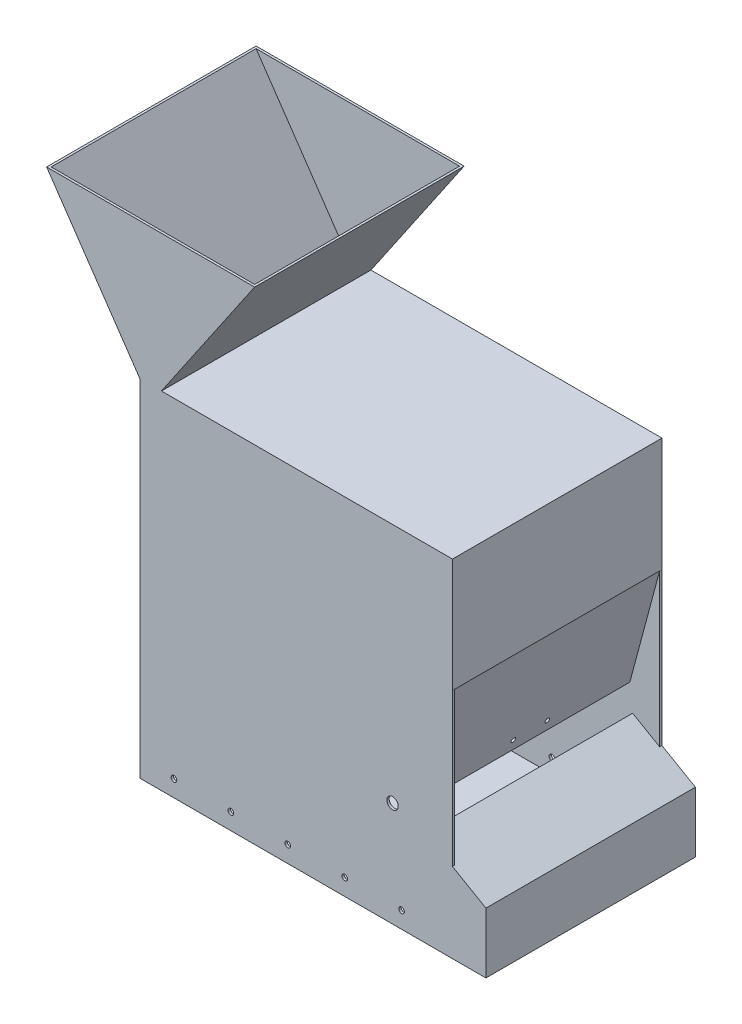
from build123d import *

# Parameters (mm, degrees)
EXTRUDE_3_DEPTH           = 180
EXTRUDE_4_DEPTH           = 2
EXTRUDE_5_DEPTH           = 180
CUT_EXTRUDE_8_DEPTH       = 6
CUT_EXTRUDE_8_DEPTH_BACK  = 14
SKETCH_10_R               = 5
SKETCH_10_R_2             = 6
CUT_EXTRUDE_9_DEPTH       = 180
SKETCH_11_W               = 274.631033311
SKETCH_11_H               = 184
SKETCH_11_W_2             = 270.631033311
SKETCH_11_H_2             = 180
EXTRUDE_1_DEPTH           = 100
EXTRUDE_START             = -2
EXTRUDE_6_DEPTH           = 92
EXTRUDE_12_DEPTH          = 2
MIRROR_6_COPY_1_DEPTH     = 2
MIRROR_6_COPY_2_DEPTH     = 2
EXTRUDE_13_DEPTH          = 180
SKETCH_19_R               = 5
SKETCH_19_R_2             = 6
CUT_EXTRUDE_10_DEPTH      = 10
CUT_EXTRUDE_START         = -10
SKETCH_20_R               = 5
CUT_EXTRUDE_11_DEPTH      = 10
SKETCH_21_R               = 2
CUT_EXTRUDE_12_DEPTH      = 10
CUT_EXTRUDE_13_DEPTH      = 550.919994181
CUT_EXTRUDE_13_DEPTH_BACK = 550.919994181
SKETCH_22_R               = 2.5


with BuildPart() as part:
    # 草图1 → 凸台-拉伸3 (new body)
    with BuildSketch(Plane.XY):
        with BuildLine():
            Line((300, 0), (0, 0))
            Line((0, 0), (0, 200))
            Line((0, 200), (270, 200))
            Line((270, 200), (244.977927003, 106.616352266))
            ThreePointArc((244.977927003, 106.616352266), (245.721361032, 105.440582458), (246.409490454, 104.231613188))
            Line((246.409490454, 104.231613188), (272.606450746, 202))
            Line((272.606450746, 202), (-2, 202))
            Line((-2, 202), (-2, -2))
            Line((-2, -2), (302, -2))
            Line((302, -2), (302, 51.154700538))
            Line((302, 51.154700538), (248.866473036, 81.831356634))
            ThreePointArc((248.866473036, 81.831356634), (248.571049064, 80.851494363), (248.242374569, 79.882278975))
            Line((248.242374569, 79.882278975), (300, 50))
            Line((300, 50), (300, 0))
        make_face()
    extrude(amount=EXTRUDE_3_DEPTH)

    # 草图7 → 凸台-拉伸4 (add)
    with BuildSketch(Plane(origin=(0, 0, 0), x_dir=(-1, 0, 0), z_dir=(0, 0, -1))):
        Polygon((-272.606450746, 68.125074113), (-275.433236518, 66.493028586), (-302, 51.154700538), (-302, -2), (2, -2), (2, 202), (-272.606450746, 202), align=None)
    extrude_4 = extrude(amount=EXTRUDE_4_DEPTH)

    # 镜向5: 凸台-拉伸4 across plane
    add(extrude_4.mirror(Plane.XY.offset(90)))

    # 草图8 → 凸台-拉伸5 (add)
    with BuildSketch(Plane.XY):
        with BuildLine():
            Line((191.022225211, 97.764571353), (0, 144.327661976))
            Line((0, 144.327661976), (0, 140.399780569))
            Line((0, 140.399780569), (190.270548779, 94.019916677))
            ThreePointArc((190.270548779, 94.019916677), (190.586734182, 95.904218314), (191.022225211, 97.764571353))
        make_face()
    extrude(amount=EXTRUDE_5_DEPTH)

    # 草图10 → 切除-拉伸8 (cut, two sides: drawn at the far end of the back side and taken through both)
    with BuildSketch(Plane.XY.offset(-CUT_EXTRUDE_8_DEPTH_BACK)):
        with Locations(Location((60, 60, 0), (0, 0, 180))):
            Circle(SKETCH_10_R)
        with Locations(Location((95, 60, 0), (0, 0, 180))):
            Circle(SKETCH_10_R_2)
    extrude(amount=CUT_EXTRUDE_8_DEPTH + CUT_EXTRUDE_8_DEPTH_BACK, mode=Mode.SUBTRACT)

    # 草图8<3> → 切除-拉伸9 (cut)
    with BuildSketch(Plane.XY):
        Polygon((0, 200), (270, 200), (270.631033311, 202), (0, 202), align=None)
    extrude(amount=CUT_EXTRUDE_9_DEPTH, mode=Mode.SUBTRACT)

    # 草图11 → 拉伸-薄壁1 (add)
    with BuildSketch(Plane(origin=(0, 202, 0), x_dir=(1, 0, 0), z_dir=(0, 1, 0))):
        with Locations((135.315516656, -90)):
            Rectangle(SKETCH_11_W, SKETCH_11_H)
        with Locations((135.315516656, -90)):
            Rectangle(SKETCH_11_W_2, SKETCH_11_H_2, mode=Mode.SUBTRACT)
    extrude(amount=EXTRUDE_1_DEPTH)

    # 草图12 → 凸台-拉伸6 (add)
    with BuildSketch(Plane(origin=(0, 0, 180), x_dir=(-1, 0, 0), z_dir=(0, 0, -1)).offset(EXTRUDE_START)):
        Polygon((-98.869083806, 422), (-96.869083806, 422), (-15, 302), (-17, 302), align=None)
        Polygon((83.869083806, 422), (81.869083806, 422), (0, 302), (2, 302), align=None)
    extrude_6 = extrude(amount=EXTRUDE_6_DEPTH)

    # 草图16 → 凸台-拉伸12 (add)
    with BuildSketch(Plane.XY.offset(182)):
        Polygon((-83.869083806, 422), (98.869083806, 422), (17, 302), (-2, 302), align=None)
    extrude_12 = extrude(amount=-EXTRUDE_12_DEPTH)

    # 镜向6: 凸台-拉伸6 across plane
    add(extrude_6.mirror(Plane.XY.offset(90)))

    # 镜向6 copy 1 sketch → 镜向6 copy 1 (add)
    with BuildSketch(Plane(origin=(0, 0, 0), x_dir=(-1, 0, 0), z_dir=(0, 0, -1))):
        Polygon((-272.606450746, 68.125074113), (-275.433236518, 66.493028586), (-302, 51.154700538), (-302, -2), (2, -2), (2, 202), (-272.606450746, 202), align=None)
    extrude(amount=MIRROR_6_COPY_1_DEPTH)

    # 镜向6 copy 2 sketch → 镜向6 copy 2 (add)
    with BuildSketch(Plane(origin=(0, 0, 180), x_dir=(-1, 0, 0), z_dir=(0, 0, 1))):
        Polygon((-272.606450746, -68.125074113), (-275.433236518, -66.493028586), (-302, -51.154700538), (-302, 2), (2, 2), (2, -202), (-272.606450746, -202), align=None)
    extrude(amount=MIRROR_6_COPY_2_DEPTH)

    # 镜向7: 凸台-拉伸12 across plane
    add(extrude_12.mirror(Plane.XY.offset(90)))

    # 草图17 → 凸台-拉伸13 (add)
    with BuildSketch(Plane(origin=(0, 0, 180), x_dir=(-1, 0, 0), z_dir=(0, 0, -1))):
        Polygon((-15, 302), (-15, 252), (-10, 232.268619303), (-11.900860885, 231.877388977), (-17, 252), (-17, 300), (-270.631033311, 300), (-270.631033311, 302), (-17, 302), align=None)
    extrude(amount=EXTRUDE_13_DEPTH)

    # 草图19 → 切除-拉伸10 (cut)
    with BuildSketch(Plane.XY):
        with Locations((60, 60)):
            Circle(SKETCH_19_R)
        with Locations((95, 60)):
            Circle(SKETCH_19_R_2)
        with Locations((220, 90)):
            Circle(SKETCH_19_R)
    extrude(amount=-CUT_EXTRUDE_10_DEPTH, mode=Mode.SUBTRACT)

    # 草图20 → 切除-拉伸11 (cut)
    with BuildSketch(Plane(origin=(0, 0, 180), x_dir=(-1, 0, 0), z_dir=(0, 0, -1)).offset(CUT_EXTRUDE_START)):
        with Locations(Location((-220, 90, 0), (0, 0, 180))):
            Circle(SKETCH_20_R)
    extrude(amount=CUT_EXTRUDE_11_DEPTH, mode=Mode.SUBTRACT)

    # 草图21 → 切除-拉伸12 (cut)
    with BuildSketch(Plane(origin=(203.845281163, -54.620178469, 0), x_dir=(0, 0, -1), z_dir=(0.9659258262890673, -0.25881904510252457, 0))):
        with Locations(Location((-105, 174.455476118, 0), (0, 0, 90))):
            Circle(SKETCH_21_R)
        with Locations(Location((-75, 174.455476118, 0), (0, 0, 90))):
            Circle(SKETCH_21_R)
    extrude(amount=-CUT_EXTRUDE_12_DEPTH, mode=Mode.SUBTRACT)

    # 草图22 → 切除-拉伸13 (cut, two sides: drawn at the far end of the back side and taken through both)
    with BuildSketch(Plane.XY.offset(-CUT_EXTRUDE_13_DEPTH_BACK)):
        with Locations((28, 12.5)):
            Circle(SKETCH_22_R)
        with Locations((78, 12.5)):
            Circle(SKETCH_22_R)
        with Locations((128, 12.5)):
            Circle(SKETCH_22_R)
        with Locations((178, 12.5)):
            Circle(SKETCH_22_R)
        with Locations((228, 12.5)):
            Circle(SKETCH_22_R)
    extrude(amount=CUT_EXTRUDE_13_DEPTH + CUT_EXTRUDE_13_DEPTH_BACK, mode=Mode.SUBTRACT)


solid = part.part
